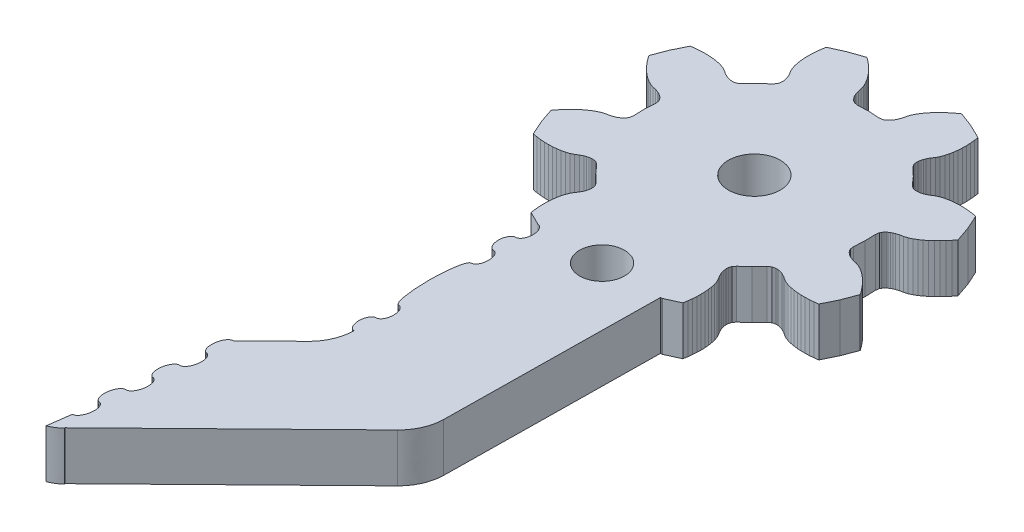
from build123d import *

# Parameters (mm, degrees)
SKETCH1_R           = 1.7
SKETCH1_R_2         = 1.46808505
BOSS_EXTRUDE1_DEPTH = 3.175


with BuildPart() as part:
    # Sketch1 → Boss-Extrude1 (new body)
    with BuildSketch(Plane(origin=(0, 0, 0), x_dir=(1, 0, 0), z_dir=(0, 1, 0))):
        with BuildLine():
            Line((-7.608121724, -56.222536201), (-7.511395729, -56.222536201))
            Line((-7.511395729, -56.222536201), (-6.57164643, -55.796520411))
            Line((-6.57164643, -55.796520411), (-6.525067433, -55.514967736))
            Line((-6.525067433, -55.514967736), (-6.492175525, -55.237702467))
            Line((-6.492175525, -55.237702467), (-6.472561264, -54.965427778))
            Line((-6.472561264, -54.965427778), (-6.467004539, -54.698524554))
            Line((-6.467004539, -54.698524554), (-6.47531038, -54.437647137))
            Line((-6.47531038, -54.437647137), (-6.497927222, -54.183996783))
            Line((-6.497927222, -54.183996783), (-6.535810433, -53.937964143))
            Line((-6.535810433, -53.937964143), (-6.589603423, -53.701531776))
            Line((-6.589603423, -53.701531776), (-6.662367264, -53.47655528))
            Line((-6.662367264, -53.47655528), (-6.764143055, -53.270652368))
            Line((-6.764143055, -53.270652368), (-6.887131884, -53.078705499))
            Line((-6.887131884, -53.078705499), (-6.9880108, -52.871904088))
            Line((-6.9880108, -52.871904088), (-7.027999717, -52.761564426))
            Line((-7.027999717, -52.761564426), (-7.05956581, -52.644886435))
            Line((-7.05956581, -52.644886435), (-7.079823482, -52.520649327))
            Line((-7.079823482, -52.520649327), (-7.084541823, -52.454209186))
            Line((-7.084541823, -52.454209186), (-7.084366347, -52.384380138))
            Line((-7.084366347, -52.384380138), (-7.077659284, -52.309433548))
            Line((-7.077659284, -52.309433548), (-7.060969614, -52.226742283))
            Line((-7.060969614, -52.226742283), (-7.026030492, -52.12984105))
            Line((-7.026030492, -52.12984105), (-6.886936911, -51.949857899))
            Line((-6.886936911, -51.949857899), (-6.358131739, -51.483585419))
            Line((-6.358131739, -51.483585419), (-5.876217521, -50.968666996))
            Line((-5.876217521, -50.968666996), (-5.692221709, -50.834966343))
            Line((-5.692221709, -50.834966343), (-5.594403866, -50.8032161))
            Line((-5.594403866, -50.8032161), (-5.511481943, -50.789074497))
            Line((-5.511481943, -50.789074497), (-5.436475915, -50.784533167))
            Line((-5.436475915, -50.784533167), (-5.366773146, -50.786515726))
            Line((-5.366773146, -50.786515726), (-5.300657877, -50.793430267))
            Line((-5.300657877, -50.793430267), (-5.177162119, -50.817553029))
            Line((-5.177162119, -50.817553029), (-5.061952703, -50.852760542))
            Line((-5.061952703, -50.852760542), (-4.95296292, -50.896474503))
            Line((-4.95296292, -50.896474503), (-4.749937765, -51.003874509))
            Line((-4.749937765, -51.003874509), (-4.562159481, -51.13290687))
            Line((-4.562159481, -51.13290687), (-4.360011704, -51.241390935))
            Line((-4.360011704, -51.241390935), (-4.137820725, -51.321210908))
            Line((-4.137820725, -51.321210908), (-3.903658417, -51.382719068))
            Line((-3.903658417, -51.382719068), (-3.659533, -51.428220262))
            Line((-3.659533, -51.428220262), (-3.406926267, -51.458876679))
            Line((-3.406926267, -51.458876679), (-3.147222526, -51.475391493))
            Line((-3.147222526, -51.475391493), (-2.880616747, -51.47814559))
            Line((-2.880616747, -51.47814559), (-2.608259272, -51.467265931))
            Line((-2.608259272, -51.467265931), (-2.330598537, -51.442947843))
            Line((-2.330598537, -51.442947843), (-2.048277953, -51.405181559))
            Line((-2.048277953, -51.405181559), (-1.593698918, -50.477568579))
            Line((-1.593698918, -50.477568579), (-1.229860215, -49.510519278))
            Line((-1.229860215, -49.510519278), (-1.395587077, -49.278501279))
            Line((-1.395587077, -49.278501279), (-1.568021003, -49.059159938))
            Line((-1.568021003, -49.059159938), (-1.746577074, -48.852876141))
            Line((-1.746577074, -48.852876141), (-1.93090434, -48.659962409))
            Line((-1.93090434, -48.659962409), (-2.120905313, -48.48145397))
            Line((-2.120905313, -48.48145397), (-2.316092562, -48.318180959))
            Line((-2.316092562, -48.318180959), (-2.516251617, -48.171041877))
            Line((-2.516251617, -48.171041877), (-2.721265495, -48.042068114))
            Line((-2.721265495, -48.042068114), (-2.93152414, -47.934472782))
            Line((-2.93152414, -47.934472782), (-3.148821302, -47.861000904))
            Line((-3.148821302, -47.861000904), (-3.371207254, -47.812159636))
            Line((-3.371207254, -47.812159636), (-3.588562908, -47.737408372))
            Line((-3.588562908, -47.737408372), (-3.694862068, -47.68786393))
            Line((-3.694862068, -47.68786393), (-3.799328483, -47.627830482))
            Line((-3.799328483, -47.627830482), (-3.901669694, -47.554163278))
            Line((-3.901669694, -47.554163278), (-3.951641218, -47.510634877))
            Line((-3.951641218, -47.510634877), (-4.000891342, -47.461100201))
            Line((-4.000891342, -47.461100201), (-4.049069115, -47.403049311))
            Line((-4.049069115, -47.403049311), (-4.09545314, -47.332839378))
            Line((-4.09545314, -47.332839378), (-4.13928302, -47.239776301))
            Line((-4.13928302, -47.239776301), (-4.167905024, -47.013901305))
            Line((-4.167905024, -47.013901305), (-4.123178269, -46.309536186))
            Line((-4.123178269, -46.309536186), (-4.145795111, -45.60413584))
            Line((-4.145795111, -45.60413584), (-4.110076098, -45.379159343))
            Line((-4.110076098, -45.379159343), (-4.063380117, -45.287570978))
            Line((-4.063380117, -45.287570978), (-4.014695414, -45.218835756))
            Line((-4.014695414, -45.218835756), (-3.964860372, -45.162572099))
            Line((-3.964860372, -45.162572099), (-3.914128455, -45.114502368))
            Line((-3.914128455, -45.114502368), (-3.862714133, -45.072390081))
            Line((-3.862714133, -45.072390081), (-3.758247718, -45.002180147))
            Line((-3.758247718, -45.002180147), (-3.651929061, -44.945408643))
            Line((-3.651929061, -44.945408643), (-3.543972634, -44.899126145))
            Line((-3.543972634, -44.899126145), (-3.324511273, -44.831289422))
            Line((-3.324511273, -44.831289422), (-3.100643528, -44.789558021))
            Line((-3.100643528, -44.789558021), (-2.881182168, -44.722990917))
            Line((-2.881182168, -44.722990917), (-2.667667478, -44.622056202))
            Line((-2.667667478, -44.622056202), (-2.458617664, -44.499616094))
            Line((-2.458617664, -44.499616094), (-2.253993732, -44.358805575))
            Line((-2.253993732, -44.358805575), (-2.053698196, -44.201548605))
            Line((-2.053698196, -44.201548605), (-1.858452455, -44.029183169))
            Line((-1.858452455, -44.029183169), (-1.668139525, -43.842285478))
            Line((-1.668139525, -43.842285478), (-1.483051866, -43.641636836))
            Line((-1.483051866, -43.641636836), (-1.303969368, -43.427920884))
            Line((-1.303969368, -43.427920884), (-1.131028513, -43.201284117))
            Line((-1.131028513, -43.201284117), (-1.464392971, -42.223237961))
            Line((-1.464392971, -42.223237961), (-1.889628602, -41.281600574))
            Line((-1.889628602, -41.281600574), (-2.170486891, -41.235132517))
            Line((-2.170486891, -41.235132517), (-2.447250751, -41.201975927))
            Line((-2.447250751, -41.201975927), (-2.71921828, -41.182521456))
            Line((-2.71921828, -41.182521456), (-2.985648583, -41.176886301))
            Line((-2.985648583, -41.176886301), (-3.245917746, -41.185275553))
            Line((-3.245917746, -41.185275553), (-3.499245878, -41.20793337))
            Line((-3.499245878, -41.20793337), (-3.744638618, -41.245689887))
            Line((-3.744638618, -41.245689887), (-3.980653167, -41.299717061))
            Line((-3.980653167, -41.299717061), (-4.205222814, -41.372485766))
            Line((-4.205222814, -41.372485766), (-4.410743621, -41.474641268))
            Line((-4.410743621, -41.474641268), (-4.602538343, -41.597843148))
            Line((-4.602538343, -41.597843148), (-4.808956025, -41.698719265))
            Line((-4.808956025, -41.698719265), (-4.919115645, -41.738975955))
            Line((-4.919115645, -41.738975955), (-5.035377913, -41.770530872))
            Line((-5.035377913, -41.770530872), (-5.159575574, -41.790883842))
            Line((-5.159575574, -41.790883842), (-5.22571034, -41.795620497))
            Line((-5.22571034, -41.795620497), (-5.295608082, -41.795425171))
            Line((-5.295608082, -41.795425171), (-5.370419137, -41.788520397))
            Line((-5.370419137, -41.788520397), (-5.452834131, -41.771810257))
            Line((-5.452834131, -41.771810257), (-5.549501635, -41.736993396))
            Line((-5.549501635, -41.736993396), (-5.729344526, -41.597462262))
            Line((-5.729344526, -41.597462262), (-6.194764047, -41.067699062))
            Line((-6.194764047, -41.067699062), (-6.708751288, -40.585107093))
            Line((-6.708751288, -40.585107093), (-6.84203468, -40.400768173))
            Line((-6.84203468, -40.400768173), (-6.873912729, -40.302782881))
            Line((-6.873912729, -40.302782881), (-6.888028758, -40.219700963))
            Line((-6.888028758, -40.219700963), (-6.892376651, -40.144559048))
            Line((-6.892376651, -40.144559048), (-6.890582902, -40.07454444))
            Line((-6.890582902, -40.07454444), (-6.883680865, -40.008485184))
            Line((-6.883680865, -40.008485184), (-6.859406754, -39.88476569))
            Line((-6.859406754, -39.88476569), (-6.824272659, -39.769367085))
            Line((-6.824272659, -39.769367085), (-6.780813227, -39.660179846))
            Line((-6.780813227, -39.660179846), (-6.67342222, -39.456767341))
            Line((-6.67342222, -39.456767341), (-6.544681694, -39.268658629))
            Line((-6.544681694, -39.268658629), (-6.436393812, -39.065959064))
            Line((-6.436393812, -39.065959064), (-6.356669443, -38.843541338))
            Line((-6.356669443, -38.843541338), (-6.295272515, -38.608779008))
            Line((-6.295272515, -38.608779008), (-6.25003883, -38.364211313))
            Line((-6.25003883, -38.364211313), (-6.219233131, -38.111273899))
            Line((-6.219233131, -38.111273899), (-6.202757931, -37.850962928))
            Line((-6.202757931, -37.850962928), (-6.200203788, -37.58406947))
            Line((-6.200203788, -37.58406947), (-6.211063771, -37.311218569))
            Line((-6.211063771, -37.311218569), (-6.235337882, -37.0330548))
            Line((-6.235337882, -37.0330548), (-6.272850645, -36.750212974))
            Line((-6.272850645, -36.750212974), (-7.198971346, -36.294820152))
            Line((-7.198971346, -36.294820152), (-8.164262079, -35.930322287))
            Line((-8.164262079, -35.930322287), (-8.395733762, -36.096349395))
            Line((-8.395733762, -36.096349395), (-8.614688193, -36.269027352))
            Line((-8.614688193, -36.269027352), (-8.820715929, -36.447926443))
            Line((-8.820715929, -36.447926443), (-9.01309557, -36.632636483))
            Line((-9.01309557, -36.632636483), (-9.191281193, -36.822991444))
            Line((-9.191281193, -36.822991444), (-9.354453912, -37.018327219))
            Line((-9.354453912, -37.018327219), (-9.501326907, -37.218858666))
            Line((-9.501326907, -37.218858666), (-9.630067433, -37.424370925))
            Line((-9.630067433, -37.424370925), (-9.737341456, -37.634883531))
            Line((-9.737341456, -37.634883531), (-9.810807199, -37.852759927))
            Line((-9.810807199, -37.852759927), (-9.859355421, -38.075558538))
            Line((-9.859355421, -38.075558538), (-9.933991001, -38.29310288))
            Line((-9.933991001, -38.29310288), (-9.983436098, -38.399604386))
            Line((-9.983436098, -38.399604386), (-10.043546205, -38.504445621))
            Line((-10.043546205, -38.504445621), (-10.116894965, -38.606786683))
            Line((-10.116894965, -38.606786683), (-10.160529873, -38.657034299))
            Line((-10.160529873, -38.657034299), (-10.20997497, -38.706188089))
            Line((-10.20997497, -38.706188089), (-10.267745404, -38.754453145))
            Line((-10.267745404, -38.754453145), (-10.337818621, -38.801106762))
            Line((-10.337818621, -38.801106762), (-10.430918123, -38.844820723))
            Line((-10.430918123, -38.844820723), (-10.656365148, -38.873689907))
            Line((-10.656365148, -38.873689907), (-11.359475984, -38.828696561))
            Line((-11.359475984, -38.828696561), (-12.063581181, -38.851539938))
            Line((-12.063581181, -38.851539938), (-12.287955856, -38.815570653))
            Line((-12.287955856, -38.815570653), (-12.379573565, -38.768975634))
            Line((-12.379573565, -38.768975634), (-12.448203983, -38.720144132))
            Line((-12.448203983, -38.720144132), (-12.504356143, -38.670091842))
            Line((-12.504356143, -38.670091842), (-12.552338944, -38.619268015))
            Line((-12.552338944, -38.619268015), (-12.594180103, -38.56775078))
            Line((-12.594180103, -38.56775078), (-12.66446779, -38.463104871))
            Line((-12.66446779, -38.463104871), (-12.721126879, -38.356593599))
            Line((-12.721126879, -38.356593599), (-12.767315931, -38.248627148))
            Line((-12.767315931, -38.248627148), (-12.835049474, -38.028768193))
            Line((-12.835049474, -38.028768193), (-12.876500687, -37.80449487))
            Line((-12.876500687, -37.80449487), (-12.943142383, -37.584577317))
            Line((-12.943142383, -37.584577317), (-13.043884818, -37.370675805))
            Line((-13.043884818, -37.370675805), (-13.166113253, -37.161315623))
            Line((-13.166113253, -37.161315623), (-13.306474157, -36.956311211))
            Line((-13.306474157, -36.956311211), (-13.463446741, -36.755652803))
            Line((-13.463446741, -36.755652803), (-13.635685694, -36.559867778))
            Line((-13.635685694, -36.559867778), (-13.822060174, -36.369200295))
            Line((-13.822060174, -36.369200295), (-14.02235571, -36.183972642))
            Line((-14.02235571, -36.183972642), (-14.235870401, -36.004370377))
            Line((-14.235870401, -36.004370377), (-14.462097316, -35.831243169))
            Line((-14.462097316, -35.831243169), (-15.438384513, -36.165084617))
            Line((-15.438384513, -36.165084617), (-16.378309287, -36.591100407))
            Line((-16.378309287, -36.591100407), (-16.424693311, -36.872653082))
            Line((-16.424693311, -36.872653082), (-16.457780192, -37.149918351))
            Line((-16.457780192, -37.149918351), (-16.477024005, -37.42219304))
            Line((-16.477024005, -37.42219304), (-16.482639221, -37.68929159))
            Line((-16.482639221, -37.68929159), (-16.474469862, -37.949973681))
            Line((-16.474469862, -37.949973681), (-16.451658047, -38.203819361))
            Line((-16.451658047, -38.203819361), (-16.414145284, -38.449656675))
            Line((-16.414145284, -38.449656675), (-16.360040338, -38.686089042))
            Line((-16.360040338, -38.686089042), (-16.28739348, -38.911006941))
            Line((-16.28739348, -38.911006941), (-16.185422717, -39.11696845))
            Line((-16.185422717, -39.11696845), (-16.062628861, -39.308915319))
            Line((-16.062628861, -39.308915319), (-15.961749945, -39.51571673))
            Line((-15.961749945, -39.51571673), (-15.921761028, -39.626066158))
            Line((-15.921761028, -39.626066158), (-15.890077951, -39.742675785))
            Line((-15.890077951, -39.742675785), (-15.869937263, -39.867166817))
            Line((-15.869937263, -39.867166817), (-15.865218922, -39.933411632))
            Line((-15.865218922, -39.933411632), (-15.865413895, -40.00324068))
            Line((-15.865413895, -40.00324068), (-15.872120958, -40.078382596))
            Line((-15.872120958, -40.078382596), (-15.888791131, -40.160878535))
            Line((-15.888791131, -40.160878535), (-15.92374975, -40.257789534))
            Line((-15.92374975, -40.257789534), (-16.062823833, -40.437762919))
            Line((-16.062823833, -40.437762919), (-16.591629005, -40.904230725))
            Line((-16.591629005, -40.904230725), (-17.073543223, -41.418953822))
            Line((-17.073543223, -41.418953822), (-17.257539035, -41.552654475))
            Line((-17.257539035, -41.552654475), (-17.355161906, -41.584404718))
            Line((-17.355161906, -41.584404718), (-17.438083829, -41.598546321))
            Line((-17.438083829, -41.598546321), (-17.51328483, -41.603097417))
            Line((-17.51328483, -41.603097417), (-17.582987598, -41.601114858))
            Line((-17.582987598, -41.601114858), (-17.649122365, -41.594385877))
            Line((-17.649122365, -41.594385877), (-17.772618123, -41.570067789))
            Line((-17.772618123, -41.570067789), (-17.887808041, -41.534870042))
            Line((-17.887808041, -41.534870042), (-17.996602852, -41.491146315))
            Line((-17.996602852, -41.491146315), (-18.199842477, -41.383756076))
            Line((-18.199842477, -41.383756076), (-18.38748428, -41.254713948))
            Line((-18.38748428, -41.254713948), (-18.589944014, -41.146229883))
            Line((-18.589944014, -41.146229883), (-18.811959517, -41.066419676))
            Line((-18.811959517, -41.066419676), (-19.046102328, -41.004911516))
            Line((-19.046102328, -41.004911516), (-19.290227745, -40.959400556))
            Line((-19.290227745, -40.959400556), (-19.542717494, -40.928744139))
            Line((-19.542717494, -40.928744139), (-19.802733192, -40.912229325))
            Line((-19.802733192, -40.912229325), (-20.069163495, -40.909475228))
            Line((-20.069163495, -40.909475228), (-20.34152097, -40.920354887))
            Line((-20.34152097, -40.920354887), (-20.619181705, -40.944682741))
            Line((-20.619181705, -40.944682741), (-20.901502289, -40.982439259))
            Line((-20.901502289, -40.982439259), (-21.356061826, -41.910062005))
            Line((-21.356061826, -41.910062005), (-21.719920027, -42.87710154))
            Line((-21.719920027, -42.87710154), (-21.553998192, -43.109119539))
            Line((-21.553998192, -43.109119539), (-21.381817731, -43.32846088))
            Line((-21.381817731, -43.32846088), (-21.203242162, -43.534744677))
            Line((-21.203242162, -43.534744677), (-21.018661432, -43.727658409))
            Line((-21.018661432, -43.727658409), (-20.828855432, -43.906166848))
            Line((-20.828855432, -43.906166848), (-20.633668182, -44.069635185))
            Line((-20.633668182, -44.069635185), (-20.433509127, -44.216784033))
            Line((-20.433509127, -44.216784033), (-20.228358769, -44.345552704))
            Line((-20.228358769, -44.345552704), (-20.018295097, -44.453148036))
            Line((-20.018295097, -44.453148036), (-19.80095894, -44.52662968))
            Line((-19.80095894, -44.52662968), (-19.578553491, -44.575461182))
            Line((-19.578553491, -44.575461182), (-19.361197836, -44.650222212))
            Line((-19.361197836, -44.650222212), (-19.254957169, -44.699756888))
            Line((-19.254957169, -44.699756888), (-19.150432262, -44.759985662))
            Line((-19.150432262, -44.759985662), (-19.04809105, -44.83345754))
            Line((-19.04809105, -44.83345754), (-18.998119527, -44.876985941))
            Line((-18.998119527, -44.876985941), (-18.948869403, -44.926715943))
            Line((-18.948869403, -44.926715943), (-18.900886602, -44.984581273))
            Line((-18.900886602, -44.984581273), (-18.854307605, -45.054791207))
            Line((-18.854307605, -45.054791207), (-18.810477724, -45.147854283))
            Line((-18.810477724, -45.147854283), (-18.781738737, -45.373719513))
            Line((-18.781738737, -45.373719513), (-18.826640968, -46.07822136))
            Line((-18.826640968, -46.07822136), (-18.803965633, -46.78361194))
            Line((-18.803965633, -46.78361194), (-18.839684647, -47.008461475))
            Line((-18.839684647, -47.008461475), (-18.886380627, -47.100245166))
            Line((-18.886380627, -47.100245166), (-18.935123822, -47.168794829))
            Line((-18.935123822, -47.168794829), (-18.984900373, -47.225244045))
            Line((-18.984900373, -47.225244045), (-19.03563229, -47.27311845))
            Line((-19.03563229, -47.27311845), (-19.087066109, -47.315230737))
            Line((-19.087066109, -47.315230737), (-19.191513027, -47.385450437))
            Line((-19.191513027, -47.385450437), (-19.297831683, -47.442221941))
            Line((-19.297831683, -47.442221941), (-19.405807608, -47.488494673))
            Line((-19.405807608, -47.488494673), (-19.625249471, -47.556526722))
            Line((-19.625249471, -47.556526722), (-19.848941741, -47.598072564))
            Line((-19.848941741, -47.598072564), (-20.068637068, -47.664825227))
            Line((-20.068637068, -47.664825227), (-20.281976283, -47.765564616))
            Line((-20.281976283, -47.765564616), (-20.491143081, -47.88820005))
            Line((-20.491143081, -47.88820005), (-20.69578651, -48.028815243))
            Line((-20.69578651, -48.028815243), (-20.895867576, -48.186081979))
            Line((-20.895867576, -48.186081979), (-21.091503263, -48.358437649))
            Line((-21.091503263, -48.358437649), (-21.28183569, -48.54533534))
            Line((-21.28183569, -48.54533534), (-21.466728376, -48.745983982))
            Line((-21.466728376, -48.745983982), (-21.645869366, -48.95989526))
            Line((-21.645869366, -48.95989526), (-21.818810221, -49.186463663))
            Line((-21.818810221, -49.186463663), (-21.485562747, -50.164578183))
            Line((-21.485562747, -50.164578183), (-21.060132143, -51.106020244))
            Line((-21.060132143, -51.106020244), (-20.779273854, -51.152683627))
            Line((-20.779273854, -51.152683627), (-20.50239301, -51.185644891))
            Line((-20.50239301, -51.185644891), (-20.230542464, -51.205099362))
            Line((-20.230542464, -51.205099362), (-19.964131659, -51.210734517))
            Line((-19.964131659, -51.210734517), (-19.703901491, -51.202355031))
            Line((-19.703901491, -51.202355031), (-19.450514867, -51.179697214))
            Line((-19.450514867, -51.179697214), (-19.205122127, -51.141930931))
            Line((-19.205122127, -51.141930931), (-18.969127075, -51.087913523))
            Line((-18.969127075, -51.087913523), (-18.74461592, -51.015135052))
            Line((-18.74461592, -51.015135052), (-18.538822151, -50.912989316))
            Line((-18.538822151, -50.912989316), (-18.347417374, -50.789972996))
            Line((-18.347417374, -50.789972996), (-18.140999693, -50.68891132))
            Line((-18.140999693, -50.68891132), (-18.030664597, -50.648644863))
            Line((-18.030664597, -50.648644863), (-17.914441323, -50.617089946))
            Line((-17.914441323, -50.617089946), (-17.790185171, -50.596736976))
            Line((-17.790185171, -50.596736976), (-17.723874929, -50.592000321))
            Line((-17.723874929, -50.592000321), (-17.65417216, -50.592390973))
            Line((-17.65417216, -50.592390973), (-17.579361105, -50.599110187))
            Line((-17.579361105, -50.599110187), (-17.49680963, -50.615810561))
            Line((-17.49680963, -50.615810561), (-17.400278607, -50.650637188))
            Line((-17.400278607, -50.650637188), (-17.220416218, -50.790158556))
            Line((-17.220416218, -50.790158556), (-16.754996697, -51.319931522))
            Line((-16.754996697, -51.319931522), (-16.241009457, -51.802709051))
            Line((-16.241009457, -51.802709051), (-16.10755059, -51.987047971))
            Line((-16.10755059, -51.987047971), (-16.075867513, -52.084847703))
            Line((-16.075867513, -52.084847703), (-16.061731986, -52.167919855))
            Line((-16.061731986, -52.167919855), (-16.057403591, -52.24306177))
            Line((-16.057403591, -52.24306177), (-16.059177843, -52.313086144))
            Line((-16.059177843, -52.313086144), (-16.066079879, -52.379135634))
            Line((-16.066079879, -52.379135634), (-16.09035399, -52.502855128))
            Line((-16.09035399, -52.502855128), (-16.125507583, -52.618449059))
            Line((-16.125507583, -52.618449059), (-16.168947518, -52.727450738))
            Line((-16.168947518, -52.727450738), (-16.276143552, -52.930853477))
            Line((-16.276143552, -52.930853477), (-16.405137542, -53.118962189))
            Line((-16.405137542, -53.118962189), (-16.513425424, -53.321661754))
            Line((-16.513425424, -53.321661754), (-16.593110799, -53.54407948))
            Line((-16.593110799, -53.54407948), (-16.654507727, -53.778851576))
            Line((-16.654507727, -53.778851576), (-16.699799904, -54.023409505))
            Line((-16.699799904, -54.023409505), (-16.730391133, -54.276356685))
            Line((-16.730391133, -54.276356685), (-16.74688583, -54.53665789))
            Line((-16.74688583, -54.53665789), (-16.749556957, -54.803756441))
            Line((-16.749556957, -54.803756441), (-16.738891946, -55.076412016))
            Line((-16.738891946, -55.076412016), (-16.714422862, -55.354761344))
            Line((-16.714422862, -55.354761344), (-16.676929597, -55.637407844))
            Line((-16.676929597, -55.637407844), (-15.750789398, -56.092995992))
            Line((-15.750789398, -56.092995992), (-15.76402805, -56.092995992))
            add(Edge.make_bspline(
                [(-15.76402805, -56.092995992), (-15.53618286, -56.096062611), (-15.351621628, -56.425372494), (-15.351621628, -56.828339816)],
                knots=[324, 324, 324, 324, 325, 325, 325, 325], degree=3))
            add(Edge.make_bspline(
                [(-15.351621628, -56.828339816), (-15.351621628, -57.231443866), (-15.53618286, -57.555304154), (-15.76402805, -57.552227769)],
                knots=[325, 325, 325, 325, 326, 326, 326, 326], degree=3))
            add(Edge.make_bspline(
                [(-15.76402805, -57.552227769), (-15.99165877, -57.549161151), (-16.176220003, -57.873148401), (-16.176220003, -58.276115722)],
                knots=[326, 326, 326, 326, 327, 327, 327, 327], degree=3))
            add(Edge.make_bspline(
                [(-16.176220003, -58.276115722), (-16.176220003, -58.67909281), (-15.99165877, -59.008392928), (-15.76402805, -59.011654872)],
                knots=[327, 327, 327, 327, 328, 328, 328, 328], degree=3))
            add(Edge.make_bspline(
                [(-15.76402805, -59.011654872), (-15.53618286, -59.014926583), (-15.351621628, -59.344031374), (-15.351621628, -59.747008462)],
                knots=[328, 328, 328, 328, 329, 329, 329, 329], degree=3))
            add(Edge.make_bspline(
                [(-15.351621628, -59.747008462), (-15.351621628, -60.149917186), (-15.536182861, -60.474158359), (-15.76402805, -60.471091741)],
                knots=[329, 329, 329, 329, 330, 330, 330, 330], degree=3))
            add(Edge.make_bspline(
                [(-15.76402805, -60.471091741), (-15.991853743, -60.46071993), (-16.176356484, -61.517755923), (-16.176356484, -62.831831177)],
                knots=[330, 330, 330, 330, 331, 331, 331, 331], degree=3))
            add(Edge.make_bspline(
                [(-16.176356484, -62.831831177), (-16.176356484, -64.14609199), (-15.991853743, -65.219828357), (-15.76402805, -65.23032713)],
                knots=[331, 331, 331, 331, 332, 332, 332, 332], degree=3))
            add(Edge.make_bspline(
                [(-15.76402805, -65.23032713), (-15.536377834, -65.233589074), (-15.351816601, -65.562703632), (-15.351816601, -65.965866279)],
                knots=[332, 332, 332, 332, 333, 333, 333, 333], degree=3))
            add(Edge.make_bspline(
                [(-15.351816601, -65.965866279), (-15.351816601, -66.368648041), (-15.536377834, -66.692830617), (-15.764028051, -66.689568673)],
                knots=[333, 333, 333, 333, 334, 334, 334, 334], degree=3))
            add(Edge.make_bspline(
                [(-15.764028051, -66.689568673), (-15.991853743, -66.686492288), (-16.176356484, -67.010547902), (-16.176356484, -67.413456626)],
                knots=[334, 334, 334, 334, 335, 335, 335, 335], degree=3))
            add(Edge.make_bspline(
                [(-16.176356484, -67.413456626), (-16.176356484, -67.816423948), (-15.991853743, -68.145733831), (-15.764028051, -68.14880045)],
                knots=[335, 335, 335, 335, 336, 336, 336, 336], degree=3))
            add(Edge.make_bspline(
                [(-15.764028051, -68.14880045), (-15.77399116, -68.944568374), (-16.099049777, -69.70366384), (-16.667531909, -70.259219839)],
                knots=[336, 336, 336, 336, 337, 337, 337, 337], degree=3))
            Line((-16.667531909, -70.259219839), (-19.14193145, -72.677111665))
            add(Edge.make_bspline(
                [(-19.14193145, -72.677111665), (-19.368489819, -72.653877636), (-19.593449412, -72.987221002), (-19.644493286, -73.421362354)],
                knots=[338, 338, 338, 338, 339, 339, 339, 339], degree=3))
            add(Edge.make_bspline(
                [(-19.644493286, -73.421362354), (-19.695537159, -73.855689267), (-19.553187533, -74.226535226), (-19.326648661, -74.249769255)],
                knots=[339, 339, 339, 339, 340, 340, 340, 340], degree=3))
            add(Edge.make_bspline(
                [(-19.326648661, -74.249769255), (-19.100090292, -74.273003283), (-18.957935638, -74.643839477), (-19.008804037, -75.077990595)],
                knots=[340, 340, 340, 340, 341, 341, 341, 341], degree=3))
            add(Edge.make_bspline(
                [(-19.008804037, -75.077990595), (-19.059906402, -75.512317507), (-19.284982978, -75.845592509), (-19.511346375, -75.822417078)],
                knots=[341, 341, 341, 341, 342, 342, 342, 342], degree=3))
            add(Edge.make_bspline(
                [(-19.511346375, -75.822417078), (-19.737963236, -75.79918305), (-19.96284484, -76.132458051), (-20.013966702, -76.566599404)],
                knots=[342, 342, 342, 342, 343, 343, 343, 343], degree=3))
            add(Edge.make_bspline(
                [(-20.013966702, -76.566599404), (-20.065010576, -77.000936082), (-19.92266095, -77.371840639), (-19.696102581, -77.395006304)],
                knots=[343, 343, 343, 343, 344, 344, 344, 344], degree=3))
            add(Edge.make_bspline(
                [(-19.696102581, -77.395006304), (-19.469563708, -77.418240333), (-19.327350563, -77.789086292), (-19.378257956, -78.223227645)],
                knots=[344, 344, 344, 344, 345, 345, 345, 345], degree=3))
            add(Edge.make_bspline(
                [(-19.378257956, -78.223227645), (-19.429321327, -78.657622921), (-19.654456395, -78.990897923), (-19.880819792, -78.967663894)],
                knots=[345, 345, 345, 345, 346, 346, 346, 346], degree=3))
            add(Edge.make_bspline(
                [(-19.880819792, -78.967663894), (-20.107358664, -78.944429865), (-20.332318256, -79.277704867), (-20.38336213, -79.712100143)],
                knots=[346, 346, 346, 346, 347, 347, 347, 347], degree=3))
            add(Edge.make_bspline(
                [(-20.38336213, -79.712100143), (-20.434464495, -80.146241495), (-20.292134367, -80.517077689), (-20.065517505, -80.540311717)],
                knots=[347, 347, 347, 347, 348, 348, 348, 348], degree=3))
            add(Edge.make_bspline(
                [(-20.065517505, -80.540311717), (-19.838959136, -80.563545746), (-19.696629007, -80.934391705), (-19.747731373, -81.368728384)],
                knots=[348, 348, 348, 348, 349, 349, 349, 349], degree=3))
            add(Edge.make_bspline(
                [(-19.747731373, -81.368728384), (-19.798775246, -81.802869736), (-20.023734839, -82.136134972), (-20.250273711, -82.112900943)],
                knots=[349, 349, 349, 349, 350, 350, 350, 350], degree=3))
            Line((-20.250273711, -82.112900943), (-20.452362997, -83.617516718))
            Line((-20.452362997, -83.617516718), (-20.47969818, -83.617204196))
            add(Edge.make_bspline(
                [(-20.47969818, -83.617204196), (-20.480478071, -83.684279148), (-19.945843214, -83.400157936), (-19.707683964, -83.167573491)],
                knots=[352, 352, 352, 352, 353, 353, 353, 353], degree=3))
            Line((-19.707683964, -83.167573491), (-19.721468539, -83.12148632))
            Line((-19.721468539, -83.12148632), (-8.707202778, -72.358886533))
            Line((-8.707202778, -72.358886533), (-8.705720985, -72.355429262))
            add(Edge.make_bspline(
                [(-8.705720985, -72.355429262), (-8.133865824, -71.803203572), (-7.804576297, -71.045895338), (-7.790070322, -70.25032274)],
                knots=[356, 356, 356, 356, 357, 357, 357, 357], degree=3))
            Line((-7.790070322, -70.25032274), (-7.608121724, -56.222536201))
        make_face()
        with Locations(Location((-11.474792635, -46.204084557, 0), (0, 0, 270))):
            Circle(SKETCH1_R, mode=Mode.SUBTRACT)
        with Locations(Location((-11.47482581, -56.186084557, 0), (0, 0, 270))):
            Circle(SKETCH1_R_2, mode=Mode.SUBTRACT)
    extrude(amount=BOSS_EXTRUDE1_DEPTH)


solid = part.part
